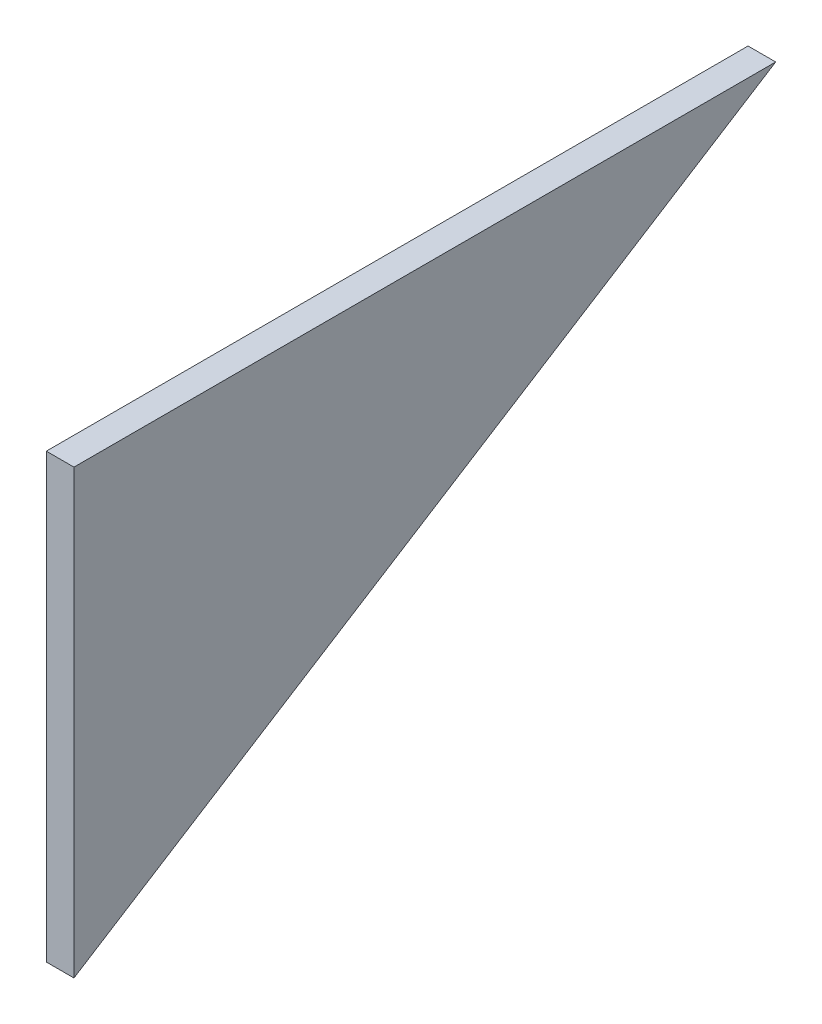
from build123d import *

# Parameters (mm, degrees)
BOSS_EXTRUDE1_DEPTH = 3


with BuildPart() as part:
    # Sketch1 → Boss-Extrude1 (new body)
    with BuildSketch(Plane(origin=(0, 0, 0), x_dir=(0, 0, -1), z_dir=(1, 0, 0))):
        Polygon((-58.536585366, -19.664634146), (17.594879877, 28.335365854), (-58.536585366, 28.335365854), align=None)
    extrude(amount=BOSS_EXTRUDE1_DEPTH)


solid = part.part
